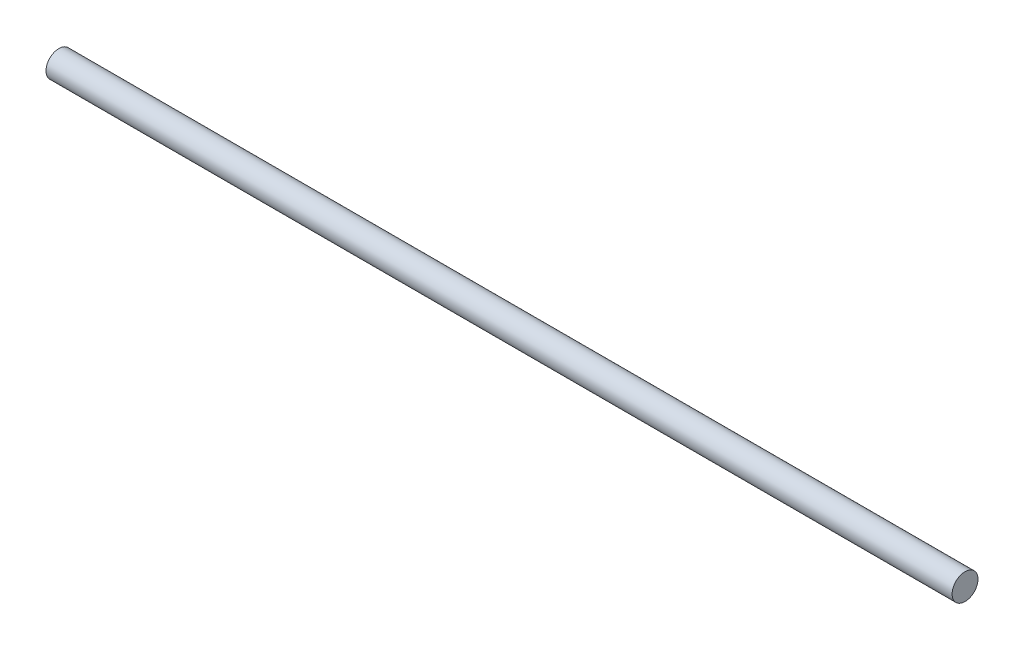
from build123d import *

# Parameters (mm, degrees)
SKETCH1_R = 1
ROD_DEPTH = 35


with BuildPart() as part:
    # Sketch1 → Rod (new, symmetric)
    with BuildSketch(Plane(origin=(0, 0, 0), x_dir=(0, 0, -1), z_dir=(1, 0, 0))):
        Circle(SKETCH1_R)
    extrude(amount=ROD_DEPTH, both=True)


solid = part.part
